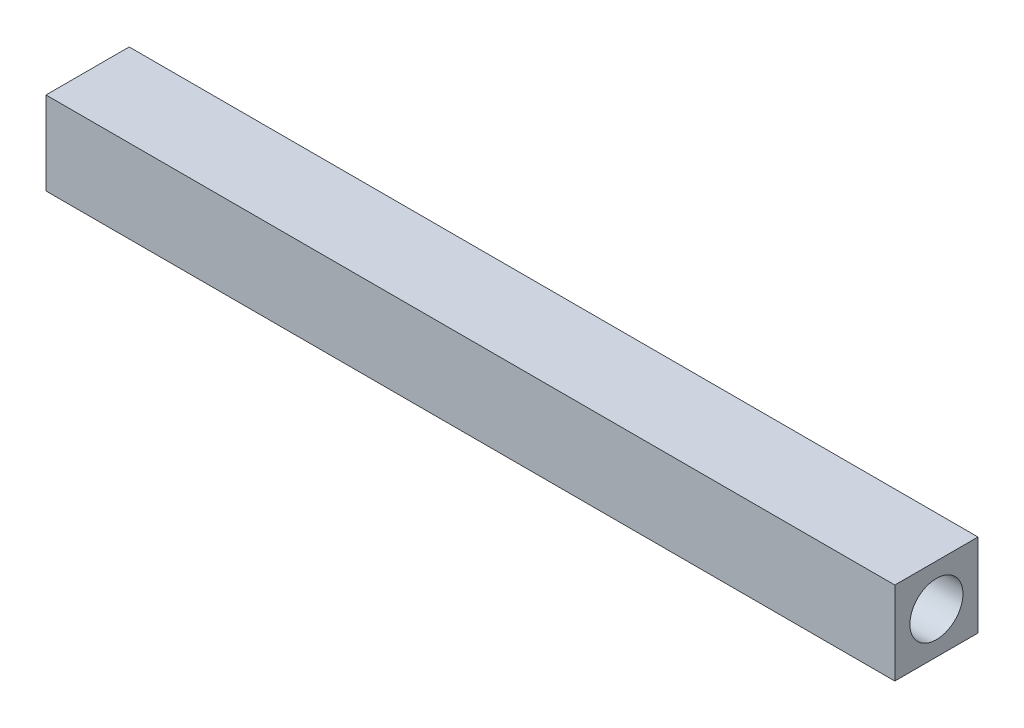
from build123d import *

# Parameters (mm, degrees)
SKETCH1_W           = 4.9784
SKETCH1_H           = 4.9784
SKETCH1_R           = 1.5875
BOSS_EXTRUDE1_DEPTH = 50.8


with BuildPart() as part:
    # Sketch1 → Boss-Extrude1 (new body)
    with BuildSketch(Plane(origin=(0, 0, 0), x_dir=(0, 0, -1), z_dir=(1, 0, 0))):
        Rectangle(SKETCH1_W, SKETCH1_H)
        Circle(SKETCH1_R, mode=Mode.SUBTRACT)
    extrude(amount=BOSS_EXTRUDE1_DEPTH)


solid = part.part
